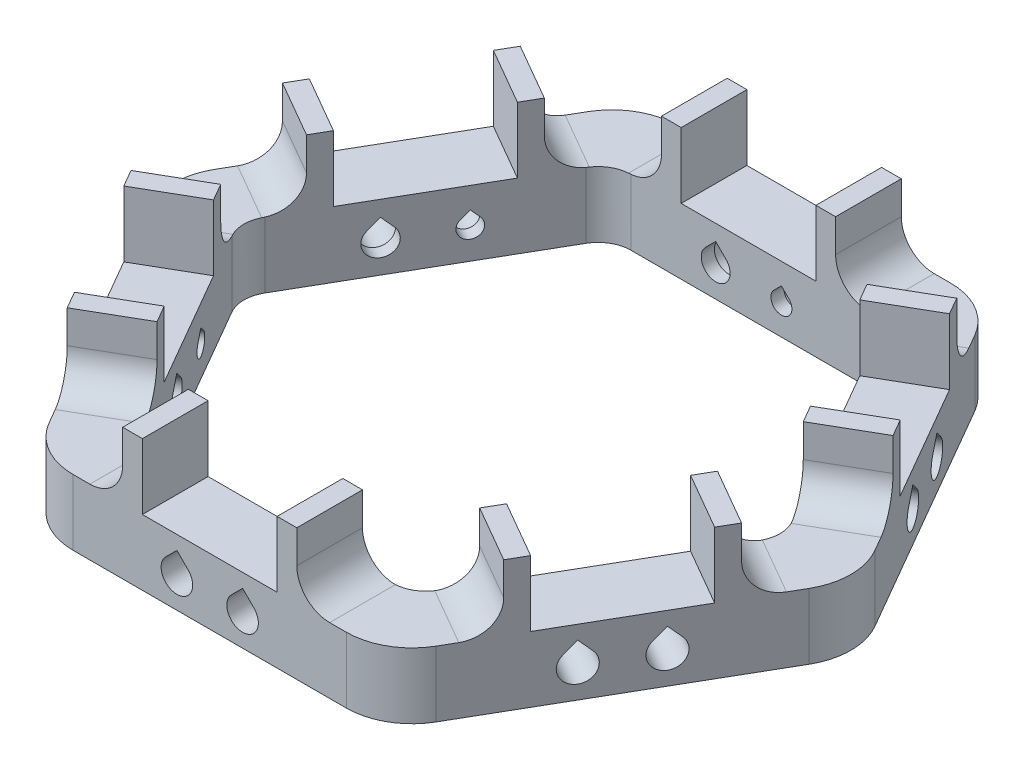
from build123d import *

# Parameters (mm, degrees)
EXTRUDE_1_DEPTH                  = 10
CUT_EXTRUDE_1_DEPTH              = 8
CUT_EXTRUDE_2_DEPTH              = 5
PATTERN_CIRCULAR_1_COUNT         = 6
SKETCH_6_W                       = 3
SKETCH_6_H                       = 10.00000000000005
EXTRUDE_2_DEPTH                  = 10
FILLET_4_R                       = 5
PATTERN_CIRCULAR_3_COUNT         = 6
FILLET_4_OF_PATTERN_CIRCULAR_3_R = 5
FILLET_5_R                       = 10
FILLET_6_R                       = 5


with BuildPart() as part:
    # 草圖1 → 填料-伸長1 (new body)
    with BuildSketch(Plane(origin=(0, 0, 0), x_dir=(1, 0, 0), z_dir=(0, 1, 0))):
        Polygon((53.11622476544559, 2.739e-14), (26.558112382722758, 46.000000000000064), (-26.558112382722793, 46.000000000000064), (-53.11622476544563, -1.125e-14), (-26.55811238272282, -46.00000000000005), (26.55811238272278, -46.00000000000006), align=None)
        Polygon((-20.784609690826542, 36.000000000000014), (-41.56921938165307, -2.6e-15), (-20.78460969082654, -36.000000000000014), (20.784609690826525, -36.00000000000002), (41.56921938165305, 4.77e-15), (20.784609690826514, 36.000000000000014), align=None, mode=Mode.SUBTRACT)
    extrude(amount=EXTRUDE_1_DEPTH)

    # 草圖2 → 除料-伸長1 (cut)
    with BuildSketch(Plane(origin=(-39.837168574084224, 0, 23.000000000000032), x_dir=(0.5000000000000001, 0, 0.8660254037844386), z_dir=(-0.8660254037844386, 0, 0.5000000000000001))):
        with BuildLine():
            Line((-5, 7.894112549695429), (-6.697056274847715, 6.197056274847714))
            ThreePointArc((-6.697056274847715, 6.197056274847714), (-5, 2.099999999999999), (-3.3029437251522853, 6.197056274847714))
            Line((-3.3029437251522853, 6.197056274847714), (-5, 7.894112549695429))
        make_face()
        with BuildLine():
            Line((3.3029437251522853, 6.197056274847713), (4.999999999999998, 7.894112549695427))
            Line((4.999999999999998, 7.894112549695427), (6.697056274847713, 6.197056274847713))
            ThreePointArc((6.697056274847713, 6.197056274847713), (4.999999999999998, 2.1000000000000014), (3.3029437251522853, 6.197056274847713))
        make_face()
    cut_extrude_1 = extrude(amount=-CUT_EXTRUDE_1_DEPTH, mode=Mode.SUBTRACT)

    # 草圖3 → 除料-伸長2 (cut)
    with BuildSketch(Plane(origin=(-32.908965343808724, 0, 19.000000000000032), x_dir=(0.5000000000000001, 0, 0.8660254037844386), z_dir=(-0.8660254037844386, 0, 0.5000000000000001))):
        with BuildLine():
            Line((-3.8686291501015226, 5.6313708498984765), (-4.999999999999999, 6.762741699796954))
            Line((-4.999999999999999, 6.762741699796954), (-6.131370849898476, 5.6313708498984765))
            ThreePointArc((-6.131370849898476, 5.6313708498984765), (-4.999999999999999, 2.8999999999999995), (-3.8686291501015226, 5.6313708498984765))
        make_face()
        with BuildLine():
            Line((6.555634918610408, 6.055634918610402), (5.000000000000001, 7.6112698372208065))
            Line((5.000000000000001, 7.6112698372208065), (3.4443650813895967, 6.055634918610405))
            ThreePointArc((3.4443650813895967, 6.055634918610405), (4.999999999999998, 2.3), (6.555634918610408, 6.055634918610402))
        make_face()
    cut_extrude_2 = extrude(amount=-CUT_EXTRUDE_2_DEPTH, mode=Mode.SUBTRACT)

    # 環狀複製排列1: 除料-伸長1, 除料-伸長2 ×6 about axis
    pattern_circular_1_axis = Axis((0, 10.499999999999998, 0), (0, -1, 0))
    add([cut_extrude_1.rotate(pattern_circular_1_axis, i * 360 / PATTERN_CIRCULAR_1_COUNT) for i in range(1, PATTERN_CIRCULAR_1_COUNT)], mode=Mode.SUBTRACT)
    add([cut_extrude_2.rotate(pattern_circular_1_axis, i * 360 / PATTERN_CIRCULAR_1_COUNT) for i in range(1, PATTERN_CIRCULAR_1_COUNT)], mode=Mode.SUBTRACT)

    # 草圖6 → 填料-伸長2 (add)
    with BuildSketch(Plane(origin=(0, 10, 0), x_dir=(1, 0, 0), z_dir=(0, 1, 0))):
        with Locations((-11.750000000000002, 41.00000000000004)):
            Rectangle(SKETCH_6_W, SKETCH_6_H)
        with Locations((11.750000000000002, 41.00000000000004)):
            Rectangle(SKETCH_6_W, SKETCH_6_H)
    extrude_2 = extrude(amount=EXTRUDE_2_DEPTH)

    # 圓角4
    fillet_4_edges = [part.edges().sort_by_distance(p)[0] for p in [
        (13.250000000000002, 10, -41.00000000000004),
        (-13.250000000000002, 10, -41.00000000000004),
    ]]
    fillet(fillet_4_edges, radius=FILLET_4_R)

    # 環狀複製排列3: 填料-伸長2 ×6 about axis
    pattern_circular_3_axis = Axis((0, 10.499999999999998, 0), (0, -1, 0))
    for i in range(1, PATTERN_CIRCULAR_3_COUNT):
        add(extrude_2.rotate(pattern_circular_3_axis, i * 360 / PATTERN_CIRCULAR_3_COUNT))

    # 圓角4 of 環狀複製排列3
    fillet_4_of_pattern_circular_3_edges = [part.edges().sort_by_distance(p)[0] for p in [
        (42.13204155516202, 10, -9.025163399856211),
        (28.882041555162015, 10, -31.97483660014384),
        (28.882041555162026, 10, 31.974836600143824),
        (42.132041555162026, 10, 9.025163399856197),
        (-13.249999999999996, 10, 41.00000000000004),
        (13.250000000000007, 10, 41.00000000000004),
        (-42.13204155516202, 10, 9.025163399856229),
        (-28.882041555162004, 10, 31.97483660014385),
        (-28.882041555162015, 10, -31.97483660014384),
        (-42.13204155516202, 10, -9.025163399856211),
    ]]
    fillet(fillet_4_of_pattern_circular_3_edges, radius=FILLET_4_OF_PATTERN_CIRCULAR_3_R)

    # 圓角5
    fillet_5_edges = [part.edges().sort_by_distance(p)[0] for p in [
        (26.558112382722758, 5, -46.000000000000064),
        (-26.558112382722793, 5, -46.000000000000064),
        (-53.11622476544563, 5, 1.125e-14),
        (-26.55811238272282, 5, 46.00000000000005),
        (26.55811238272278, 5, 46.00000000000006),
        (53.11622476544559, 5, -2.739e-14),
    ]]
    fillet(fillet_5_edges, radius=FILLET_5_R)

    # 圓角6
    fillet_6_edges = [part.edges().sort_by_distance(p)[0] for p in [
        (-20.78460969082654, 5, 36.000000000000014),
        (-41.56921938165307, 5, 2.6e-15),
        (-20.784609690826542, 5, -36.000000000000014),
        (20.784609690826514, 5, -36.000000000000014),
        (41.56921938165305, 5, -4.77e-15),
        (20.784609690826525, 5, 36.00000000000002),
    ]]
    fillet(fillet_6_edges, radius=FILLET_6_R)


solid = part.part
